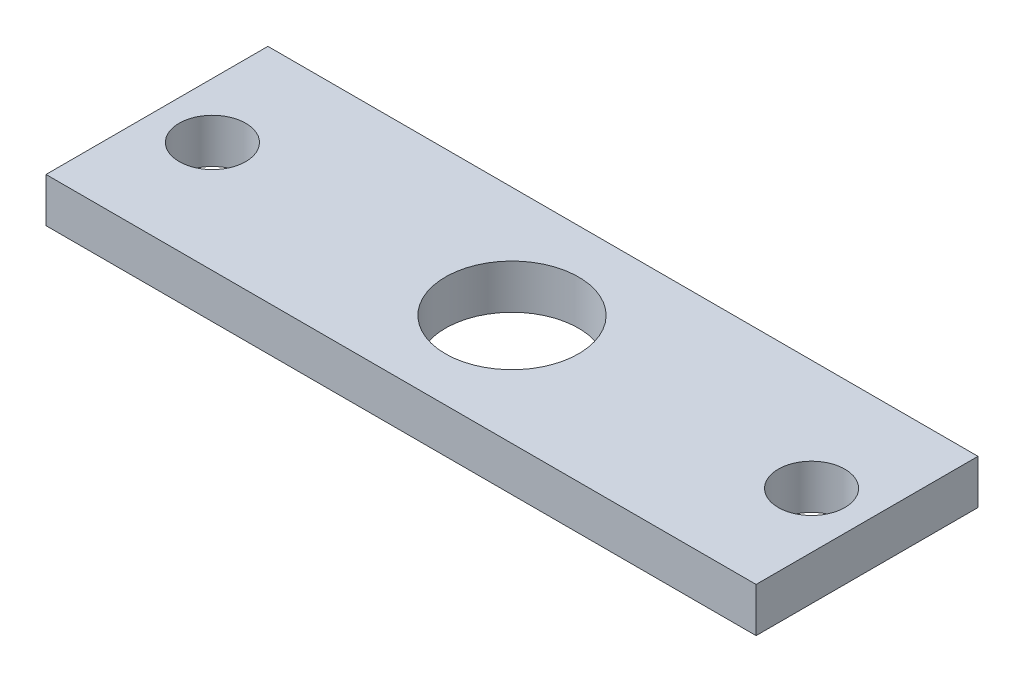
from build123d import *

# Parameters (mm, degrees)
SKETCH1_W           = 32
SKETCH1_H           = 10
BOSS_EXTRUDE1_DEPTH = 2
SKETCH2_R           = 1.5
SKETCH2_R_2         = 3
CUT_EXTRUDE1_DEPTH  = 26.925101355


with BuildPart() as part:
    # Sketch1 → Boss-Extrude1 (new body)
    with BuildSketch(Plane(origin=(0, 0, 0), x_dir=(1, 0, 0), z_dir=(0, 1, 0))):
        with Locations((-9.333333333, 0.131578947)):
            Rectangle(SKETCH1_W, SKETCH1_H)
    extrude(amount=BOSS_EXTRUDE1_DEPTH)

    # Sketch2 → Cut-Extrude1 (cut, through all)
    with BuildSketch(Plane(origin=(0, 2, 0), x_dir=(1, 0, 0), z_dir=(0, 1, 0))):
        with Locations(Location((-22.833333333, 0.131578947, 0), (0, 0, 270))):
            Circle(SKETCH2_R)
        with Locations(Location((4.166666667, 0.131578947, 0), (0, 0, 270))):
            Circle(SKETCH2_R)
        with Locations(Location((-9.333333333, 0.131578947, 0), (0, 0, 270))):
            Circle(SKETCH2_R_2)
    extrude(amount=-CUT_EXTRUDE1_DEPTH, mode=Mode.SUBTRACT)


solid = part.part
